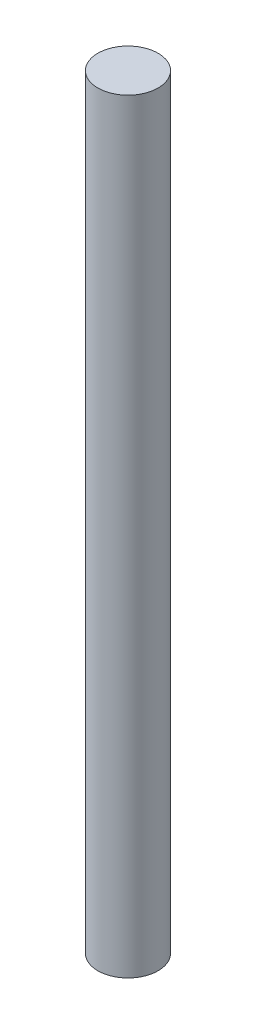
from build123d import *

# Parameters (mm, degrees)
SKETCH1_R           = 20.0152
BOSS_EXTRUDE1_DEPTH = 508
SKETCH2_R           = 12.7
CUT_EXTRUDE1_DEPTH  = 25.4


with BuildPart() as part:
    # Sketch1 → Boss-Extrude1 (new body)
    with BuildSketch(Plane(origin=(0, 0, 0), x_dir=(1, 0, 0), z_dir=(0, 1, 0))):
        with Locations(Location((0, 0, 0), (0, 0, 270))):
            Circle(SKETCH1_R)
    extrude(amount=BOSS_EXTRUDE1_DEPTH)

    # Sketch2 → Cut-Extrude1 (cut)
    with BuildSketch(Plane.XZ):
        with Locations(Location((0, 0, 0), (0, 0, 270))):
            Circle(SKETCH2_R)
    extrude(amount=-CUT_EXTRUDE1_DEPTH, mode=Mode.SUBTRACT)


solid = part.part
